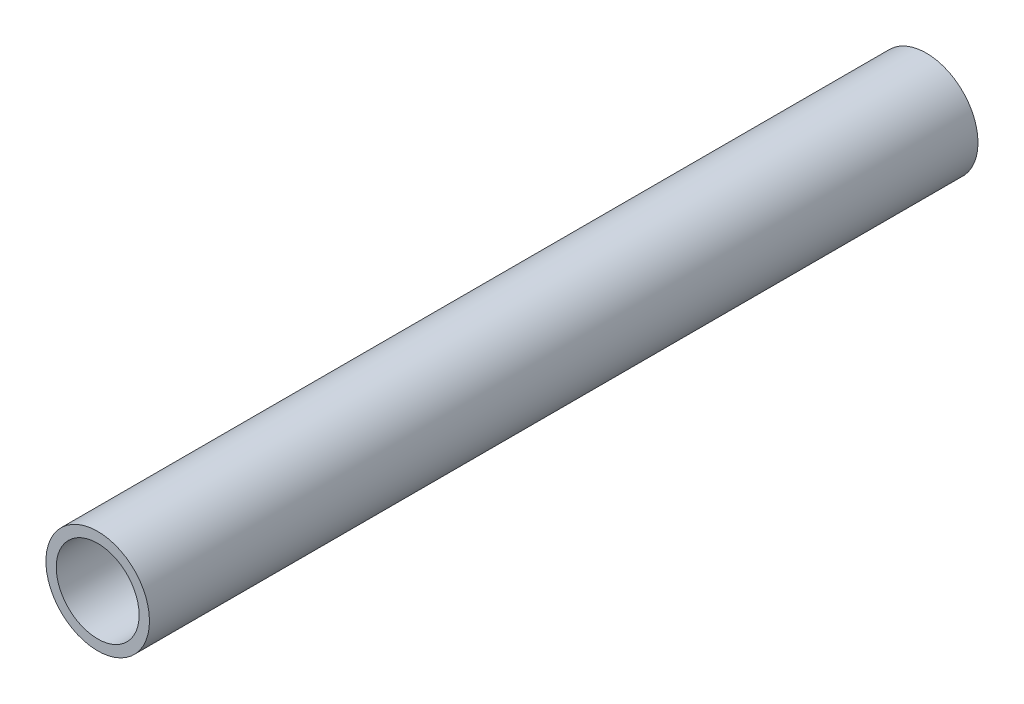
from build123d import *

# Parameters (mm, degrees)
SKETCH_1_R      = 5
SKETCH_1_R_2    = 4
EXTRUDE_1_DEPTH = 80


with BuildPart() as part:
    # ｽｹｯﾁ1 → ﾎﾞｽ - 押し出し1 (new body)
    with BuildSketch(Plane.XY):
        Circle(SKETCH_1_R)
        Circle(SKETCH_1_R_2, mode=Mode.SUBTRACT)
    extrude(amount=EXTRUDE_1_DEPTH)


solid = part.part
